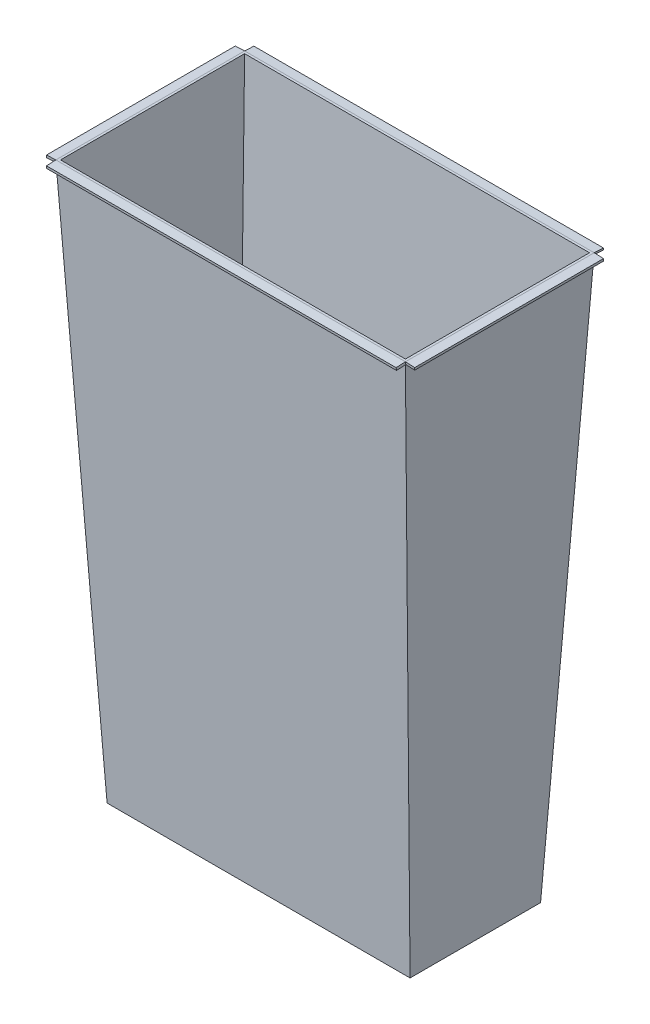
from build123d import *

# Parameters (mm, degrees)
SHELL2_T            = -3.175
BOSS_EXTRUDE3_DEPTH = 12.7
BOSS_EXTRUDE4_DEPTH = 12.7
BOSS_EXTRUDE5_DEPTH = 12.7
BOSS_EXTRUDE6_DEPTH = 12.7


with BuildPart() as part:
    # Sketch1 → Loft1 section 0
    with BuildSketch(Plane(origin=(0, 0, 0), x_dir=(1, 0, 0), z_dir=(0, 1, 0))):
        with BuildLine():
            Line((12.7, 269.875), (12.7, 12.7))
            Line((12.7, 12.7), (488.95, 12.7))
            Line((488.95, 12.7), (488.95, 269.875))
            Line((488.95, 269.875), (12.7, 269.875))
        make_face()
    # Sketch6 → Loft1 section 1
    with BuildSketch(Plane(origin=(0, -762, 0), x_dir=(1, 0, 0), z_dir=(0, 1, 0))):
        with BuildLine():
            Line((44.45, 50.8), (457.2, 50.8))
            Line((457.2, 50.8), (457.2, 228.6))
            Line((457.2, 228.6), (44.45, 228.6))
            Line((44.45, 228.6), (44.45, 50.8))
        make_face()
    loft()

    # Shell2
    shell2_openings = [part.faces().sort_by_distance(p)[0] for p in [
        (250.825, 0, -141.2875),
    ]]
    offset(amount=SHELL2_T, openings=shell2_openings, kind=Kind.INTERSECTION)

    # Sketch7 → Boss-Extrude3 (add)
    with BuildSketch(Plane(origin=(12.677989601, 0.528249567, 0), x_dir=(0, 0, 1), z_dir=(-0.9991330730923519, -0.04163054471218133, 0))):
        Polygon((-269.875, -0.528707918), (-12.7, -0.528707918), (-12.7, -3.703707918), (-269.703169927, -3.703707918), align=None)
    extrude(amount=BOSS_EXTRUDE3_DEPTH)

    # Sketch8 → Boss-Extrude4 (add)
    with BuildSketch(Plane(origin=(0, -14.575464349, -269.085495681), x_dir=(-1, 0, 0), z_dir=(0, -0.05408737784845071, -0.998536206432936))):
        with BuildLine():
            Line((-12.7, 14.596831097), (-488.95, 14.596831097))
            Line((-488.95, 14.596831097), (-488.846481323, 12.108740796))
            Line((-488.846481323, 12.108740796), (-12.803518677, 12.108740796))
            ThreePointArc((-12.803518677, 12.108740796), (-12.777627818, 13.353862222), (-12.7, 14.596831097))
        make_face()
    extrude(amount=BOSS_EXTRUDE4_DEPTH)

    # Sketch9 → Boss-Extrude5 (add)
    with BuildSketch(Plane(origin=(488.102599653, -20.337608319, 0), x_dir=(0, 0, -1), z_dir=(0.9991330730923519, -0.041630544712181326, 0))):
        Polygon((12.7, 20.355254837), (269.875, 20.355254837), (269.703169927, 17.180254837), (12.858612375, 17.180254837), align=None)
    extrude(amount=BOSS_EXTRUDE5_DEPTH)

    # Sketch10 → Boss-Extrude6 (add)
    with BuildSketch(Plane(origin=(0, 0.633416459, -12.668329177), x_dir=(1, 0, 0), z_dir=(0, -0.049937616943892316, 0.9987523388778448))):
        Polygon((12.7, -0.634207735), (488.95, -0.634207735), (489.354419625, -3.809207735), (12.832126611, -3.809207735), align=None)
    extrude(amount=BOSS_EXTRUDE6_DEPTH)


solid = part.part
